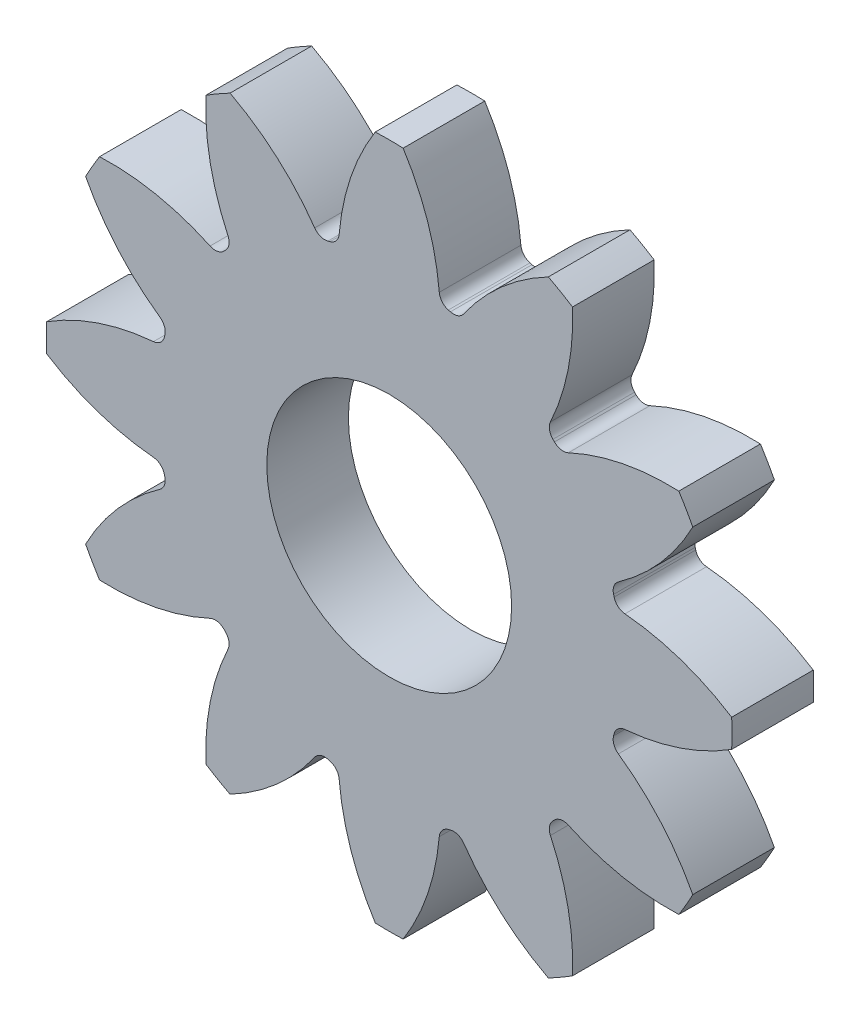
from build123d import *

# Parameters (mm, degrees)
EXTRUDE_1_DEPTH                  = 5
EXTRUDE_2_DEPTH                  = 5
CUT_EXTRUDE_1_REACH              = 27.866
SKETCH_2_R                       = 7.5
FILLET_1_R                       = 0.75
PATTERN_CIRCULAR_2_COUNT         = 12
FILLET_1_OF_PATTERN_CIRCULAR_2_R = 0.75


with BuildPart() as part:
    # 스케치1 → 보스-돌출1 (new body)
    with BuildSketch(Plane.XY):
        with BuildLine():
            ThreePointArc((-3.105, 13.907604934), (-8.911123667, -11.119998876), (14.25, 0))
            ThreePointArc((14.25, 0), (11.119998876, 8.911123667), (3.105, 13.907604934))
            ThreePointArc((3.105, 13.907604934), (0, 14.25), (-3.105, 13.907604934))
        make_face()
    extrude(amount=EXTRUDE_1_DEPTH)

    # 스케치1<3> → 보스-돌출2 (add)
    with BuildSketch(Plane.XY):
        with BuildLine():
            ThreePointArc((-3.105, 13.907604934), (0, 14.25), (3.105, 13.907604934))
            ThreePointArc((3.105, 13.907604934), (2.438479813, 17.590902841), (0.855, 20.982587424))
            ThreePointArc((0.855, 20.982587424), (0, 21), (-0.855, 20.982587424))
            ThreePointArc((-0.855, 20.982587424), (-2.438479813, 17.590902841), (-3.105, 13.907604934))
        make_face()
    extrude_2 = extrude(amount=EXTRUDE_2_DEPTH)

    # 스케치2 → 컷-돌출1 (cut, up to next)
    with BuildSketch(Plane.XY.offset(5), mode=Mode.PRIVATE) as cut_extrude_1_sk1:
        Circle(SKETCH_2_R)
    cut_extrude_1_tool1 = extrude(cut_extrude_1_sk1.sketch, amount=-CUT_EXTRUDE_1_REACH, mode=Mode.PRIVATE) & part.part
    add(cut_extrude_1_tool1.solids().sort_by_distance((0, 0, 5))[0], mode=Mode.SUBTRACT)

    # 필렛1
    fillet_1_edges = [part.edges().sort_by_distance(p)[0] for p in [
        (3.105, 13.907604934, 2.5),
        (-3.105, 13.907604934, 2.5),
    ]]
    fillet(fillet_1_edges, radius=FILLET_1_R)

    # 원형 패턴2: 보스-돌출2 ×12 about axis
    pattern_circular_2_axis = Axis((0, 0, -0.001), (0, 0, 1))
    for i in range(1, PATTERN_CIRCULAR_2_COUNT):
        add(extrude_2.rotate(pattern_circular_2_axis, i * 360 / PATTERN_CIRCULAR_2_COUNT))

    # 필렛1 of 원형 패턴2
    fillet_1_of_pattern_circular_2_edges = [part.edges().sort_by_distance(p)[0] for p in [
        (-4.264793588, 13.596839179, 2.5),
        (-9.642811346, 10.491839179, 2.5),
        (-10.491839179, 9.642811346, 2.5),
        (-13.596839179, 4.264793588, 2.5),
        (-13.907604934, 3.105, 2.5),
        (-13.907604934, -3.105, 2.5),
        (-13.596839179, -4.264793588, 2.5),
        (-10.491839179, -9.642811346, 2.5),
        (-9.642811346, -10.491839179, 2.5),
        (-4.264793588, -13.596839179, 2.5),
        (-3.105, -13.907604934, 2.5),
        (3.105, -13.907604934, 2.5),
        (4.264793588, -13.596839179, 2.5),
        (9.642811346, -10.491839179, 2.5),
        (10.491839179, -9.642811346, 2.5),
        (13.596839179, -4.264793588, 2.5),
        (13.907604934, -3.105, 2.5),
        (13.907604934, 3.105, 2.5),
        (13.596839179, 4.264793588, 2.5),
        (10.491839179, 9.642811346, 2.5),
        (9.642811346, 10.491839179, 2.5),
        (4.264793588, 13.596839179, 2.5),
    ]]
    fillet(fillet_1_of_pattern_circular_2_edges, radius=FILLET_1_OF_PATTERN_CIRCULAR_2_R)


solid = part.part
